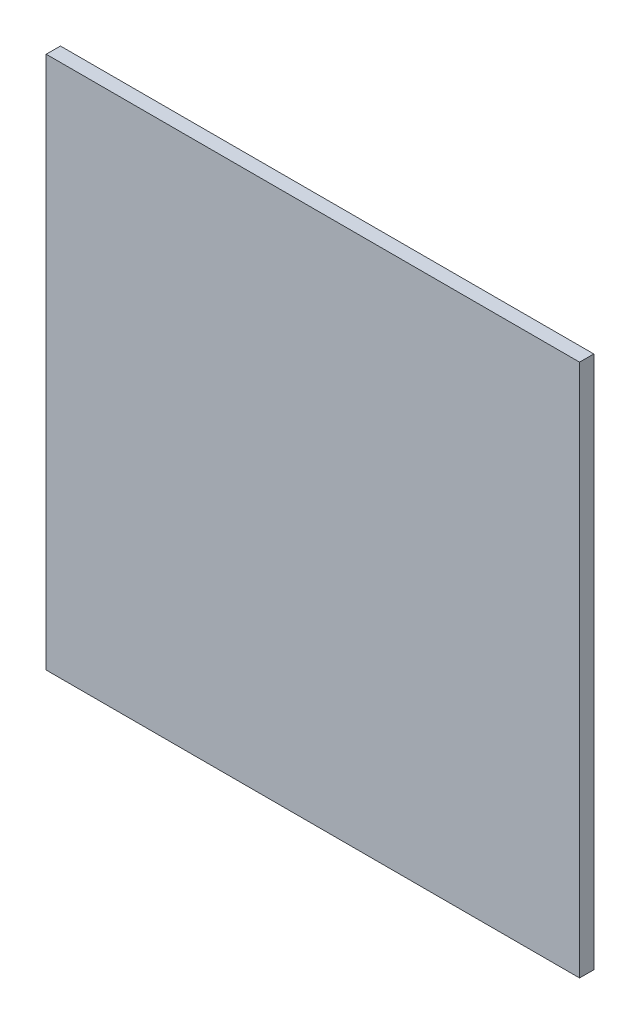
from build123d import *

# Parameters (mm, degrees)
SKETCH1_W           = 30
SKETCH1_H           = 30
BOSS_EXTRUDE1_DEPTH = 0.8


with BuildPart() as part:
    # Sketch1 → Boss-Extrude1 (new body)
    with BuildSketch(Plane.XY):
        Rectangle(SKETCH1_W, SKETCH1_H)
    extrude(amount=BOSS_EXTRUDE1_DEPTH)


solid = part.part
